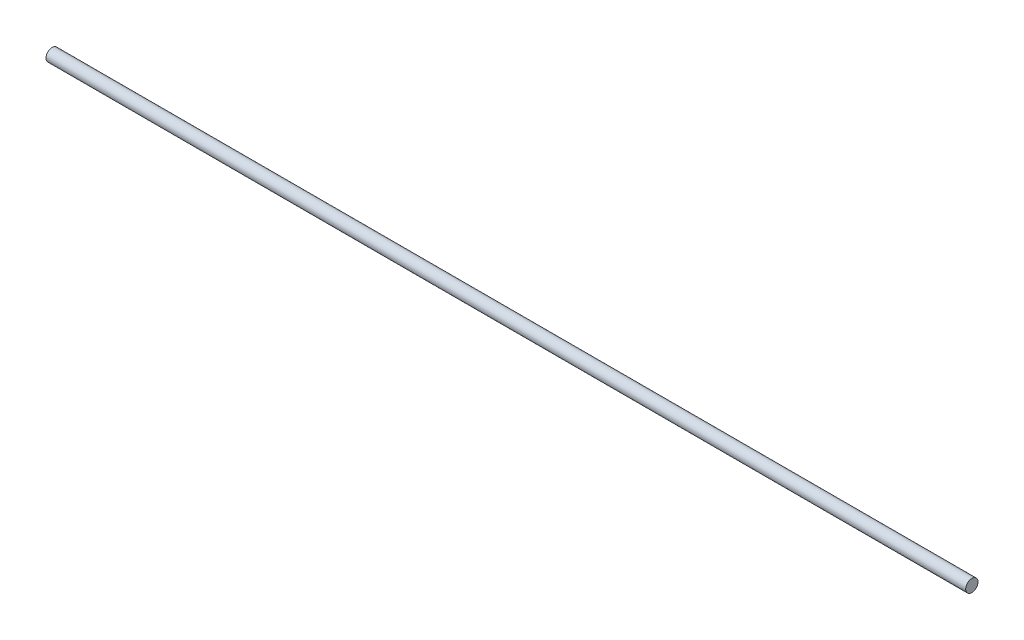
from build123d import *

# Parameters (mm, degrees)
SKETCH2_R           = 10.033
BOSS_EXTRUDE1_DEPTH = 750


with BuildPart() as part:
    # Sketch2 → Boss-Extrude1 (new, symmetric)
    with BuildSketch(Plane.YZ):
        with Locations(Location((0, 0, 0), (0, 0, 270))):
            Circle(SKETCH2_R)
    extrude(amount=BOSS_EXTRUDE1_DEPTH, both=True)


solid = part.part
